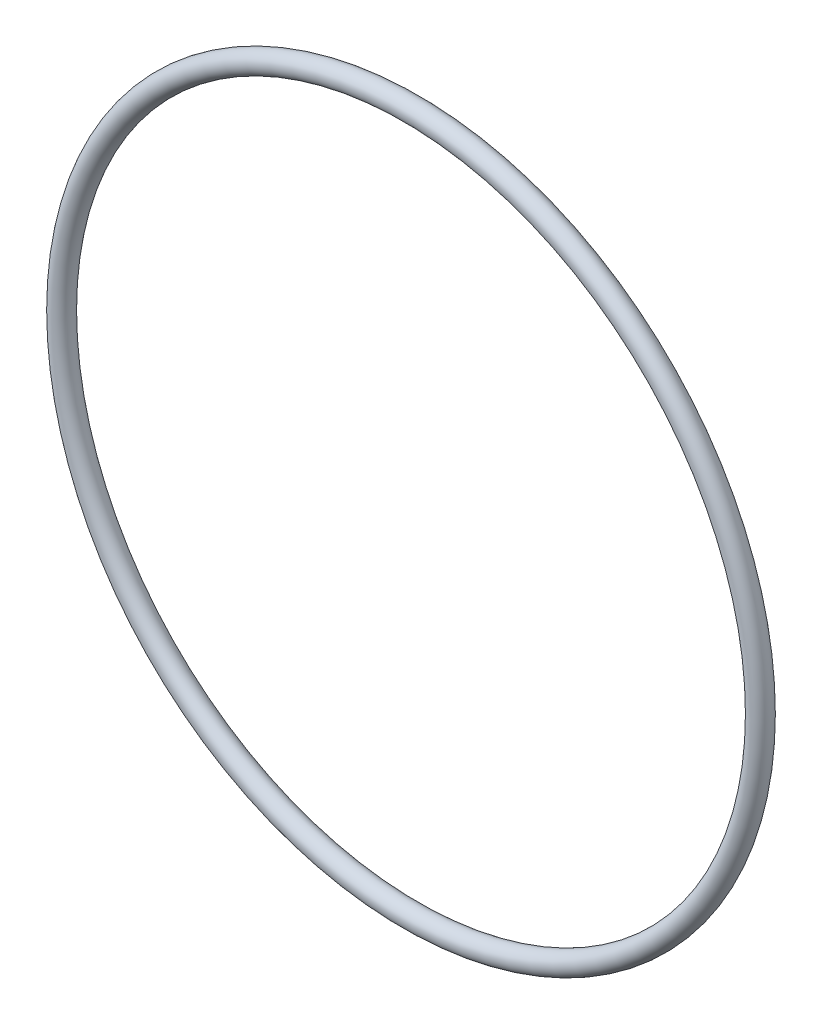
from build123d import *

# Parameters (mm, degrees)
SKETCH2_R = 1.25


with BuildPart() as part:
    # Sketch2 → Revolve1 (revolve)
    with BuildSketch(Plane(origin=(0, 0, 0), x_dir=(1, 0, 0), z_dir=(0, 1, 0))):
        with Locations((41.25, 0)):
            Circle(SKETCH2_R)
    revolve(axis=Axis((0, 0, -1.25), (0, 0, 1)))


solid = part.part
